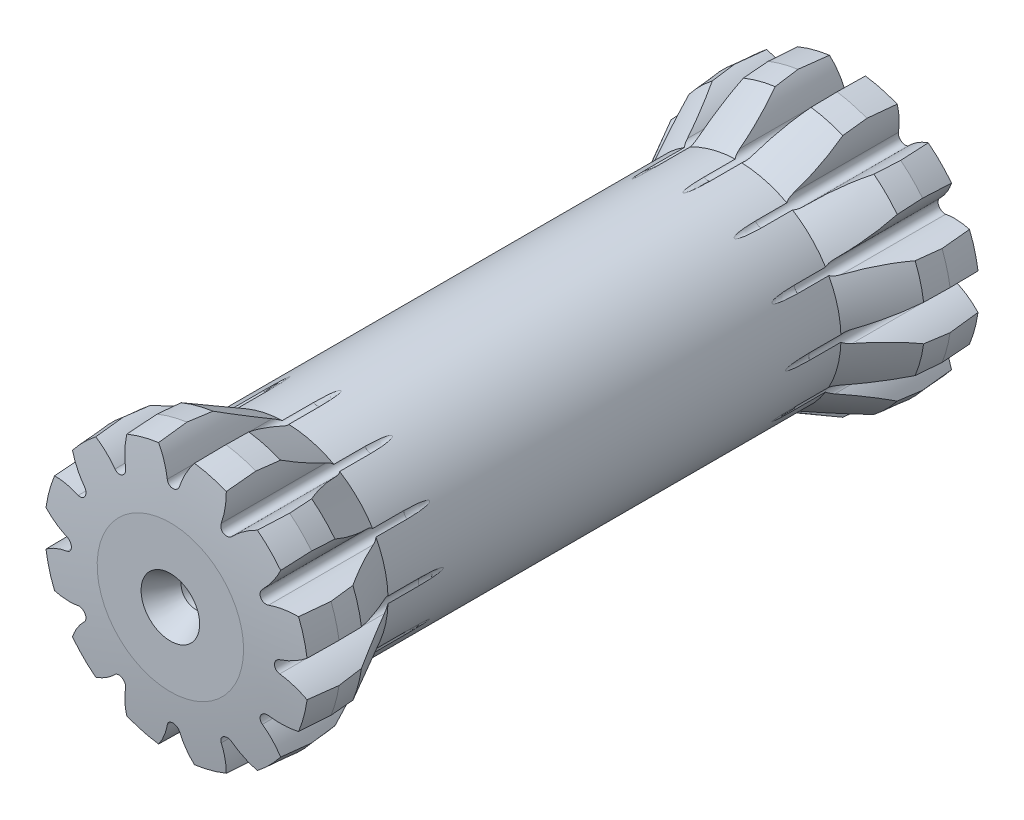
from build123d import *

# Parameters (mm, degrees)
CUT_EXTRUDE1_DEPTH = 15
CIRPATTERN1_COUNT  = 12
CUT_EXTRUDE2_START = -15
CUT_EXTRUDE2_DEPTH = 15
CIRPATTERN2_COUNT  = 12


with BuildPart() as part:
    # Sketch1 → Revolve1 (revolve)
    with BuildSketch(Plane(origin=(0, 0, 0), x_dir=(0, 0, -1), z_dir=(1, 0, 0))):
        with BuildLine():
            Line((0.633793529, 13.5), (3.7, 13.725))
            Line((3.7, 13.725), (6.2, 13.5))
            Line((6.2, 13.5), (11.8, 10.5))
            Line((11.8, 10.5), (58.2, 10.5))
            Line((58.2, 10.5), (63.8, 13.5))
            Line((63.8, 13.5), (66.3, 13.725))
            Line((66.3, 13.725), (69.366206471, 13.5))
            ThreePointArc((69.366206471, 13.5), (69.728363897, 10.504780986), (70, 7.5))
            Line((70, 7.5), (70, 0))
            Line((70, 0), (0, 0))
            Line((0, 0), (0, 7.5))
            ThreePointArc((0, 7.5), (0.271636103, 10.504780986), (0.633793529, 13.5))
        make_face()
    revolve(axis=Axis((0, 0, 0), (0, 0, -1)))

    # Sketch2 → Cut-Revolve1 (revolve, cut)
    with BuildSketch(Plane(origin=(0, 0, 0), x_dir=(0, 0, -1), z_dir=(1, 0, 0))):
        Polygon((70, 3), (67.401923789, 1.5), (64.901290929, 1.5), (64, 0), (70, 0), align=None)
    revolve(axis=Axis((0, 0, 0), (0, 0, -1)), mode=Mode.SUBTRACT)

    # Sketch3 → Cut-Revolve2 (revolve, cut)
    with BuildSketch(Plane(origin=(0, 0, 0), x_dir=(0, 0, -1), z_dir=(1, 0, 0))):
        Polygon((0, 3), (2.598076211, 1.5), (5.098709071, 1.5), (6, 0), (0, 0), align=None)
    revolve(axis=Axis((0, 0, 0), (0, 0, -1)), mode=Mode.SUBTRACT)

    # Sketch4 → Cut-Extrude1 (cut)
    with BuildSketch(Plane.XY.offset(-70)):
        with BuildLine():
            ThreePointArc((-0.629211825, 10.886927993), (0, 10.4), (0.629211825, 10.886927993))
            ThreePointArc((0.629211825, 10.886927993), (1.16769781, 12.307532038), (2, 13.578498628))
            ThreePointArc((2, 13.578498628), (0, 13.725), (-2, 13.578498628))
            ThreePointArc((-2, 13.578498628), (-1.16769781, 12.307532038), (-0.629211825, 10.886927993))
        make_face()
    cut_extrude1 = extrude(amount=CUT_EXTRUDE1_DEPTH, mode=Mode.SUBTRACT)

    # Sketch6 → Cut-Revolve3 (revolve, cut)
    with BuildSketch(Plane(origin=(0, 0, -55), x_dir=(-1, 0, 0), z_dir=(0, 0, -1))):
        with BuildLine():
            Line((-1.838226334, 13.374263492), (-1.838226334, 15.404021176))
            Line((-1.838226334, 15.404021176), (1.838226334, 15.404021176))
            Line((1.838226334, 15.404021176), (1.838226334, 13.374263492))
            ThreePointArc((1.838226334, 13.374263492), (1.109657792, 12.19089798), (0.629211825, 10.886927993))
            ThreePointArc((0.629211825, 10.886927993), (0, 10.4), (-0.629211825, 10.886927993))
            ThreePointArc((-0.629211825, 10.886927993), (-1.109657792, 12.19089798), (-1.838226334, 13.374263492))
        make_face()
    cut_revolve3 = revolve(axis=Axis((8.494917218, 41.05, -55), (-1, 0, 0)), mode=Mode.SUBTRACT)

    # CirPattern1: Cut-Extrude1, Cut-Revolve3 ×12 about axis
    cirpattern1_axis = Axis((0, 0, -58.2), (0, 0, 1))
    add([cut_extrude1.rotate(cirpattern1_axis, i * 360 / CIRPATTERN1_COUNT) for i in range(1, CIRPATTERN1_COUNT)], mode=Mode.SUBTRACT)
    add([cut_revolve3.rotate(cirpattern1_axis, i * 360 / CIRPATTERN1_COUNT) for i in range(1, CIRPATTERN1_COUNT)], mode=Mode.SUBTRACT)

    # Sketch5 → Cut-Extrude2 (cut)
    with BuildSketch(Plane.XY.offset(CUT_EXTRUDE2_START)):
        with BuildLine():
            Line((-3, 14.570711559), (-3, 15.196098841))
            Line((-3, 15.196098841), (3, 15.196098841))
            Line((3, 15.196098841), (3, 14.570711559))
            ThreePointArc((3, 14.570711559), (1.519010629, 12.919057283), (0.629211825, 10.886927993))
            ThreePointArc((0.629211825, 10.886927993), (0, 10.4), (-0.629211825, 10.886927993))
            ThreePointArc((-0.629211825, 10.886927993), (-1.519010629, 12.919057283), (-3, 14.570711559))
        make_face()
    cut_extrude2 = extrude(amount=CUT_EXTRUDE2_DEPTH, mode=Mode.SUBTRACT)

    # Sketch8 → Cut-Revolve5 (revolve, cut)
    with BuildSketch(Plane.XY.offset(-15)):
        with BuildLine():
            Line((1.838226334, 13.374263492), (1.838226334, 15.404021176))
            Line((1.838226334, 15.404021176), (-1.838226334, 15.404021176))
            Line((-1.838226334, 15.404021176), (-1.838226334, 13.374263492))
            ThreePointArc((-1.838226334, 13.374263492), (-1.109657792, 12.19089798), (-0.629211825, 10.886927993))
            ThreePointArc((-0.629211825, 10.886927993), (0, 10.4), (0.629211825, 10.886927993))
            ThreePointArc((0.629211825, 10.886927993), (1.109657792, 12.19089798), (1.838226334, 13.374263492))
        make_face()
    cut_revolve5 = revolve(axis=Axis((-13.647220523, 41.05, -15), (1, 0, 0)), mode=Mode.SUBTRACT)

    # CirPattern2: Cut-Extrude2, Cut-Revolve5 ×12 about axis
    cirpattern2_axis = Axis((0, 0, -58.2), (0, 0, 1))
    add([cut_extrude2.rotate(cirpattern2_axis, i * 360 / CIRPATTERN2_COUNT) for i in range(1, CIRPATTERN2_COUNT)], mode=Mode.SUBTRACT)
    add([cut_revolve5.rotate(cirpattern2_axis, i * 360 / CIRPATTERN2_COUNT) for i in range(1, CIRPATTERN2_COUNT)], mode=Mode.SUBTRACT)


solid = part.part
